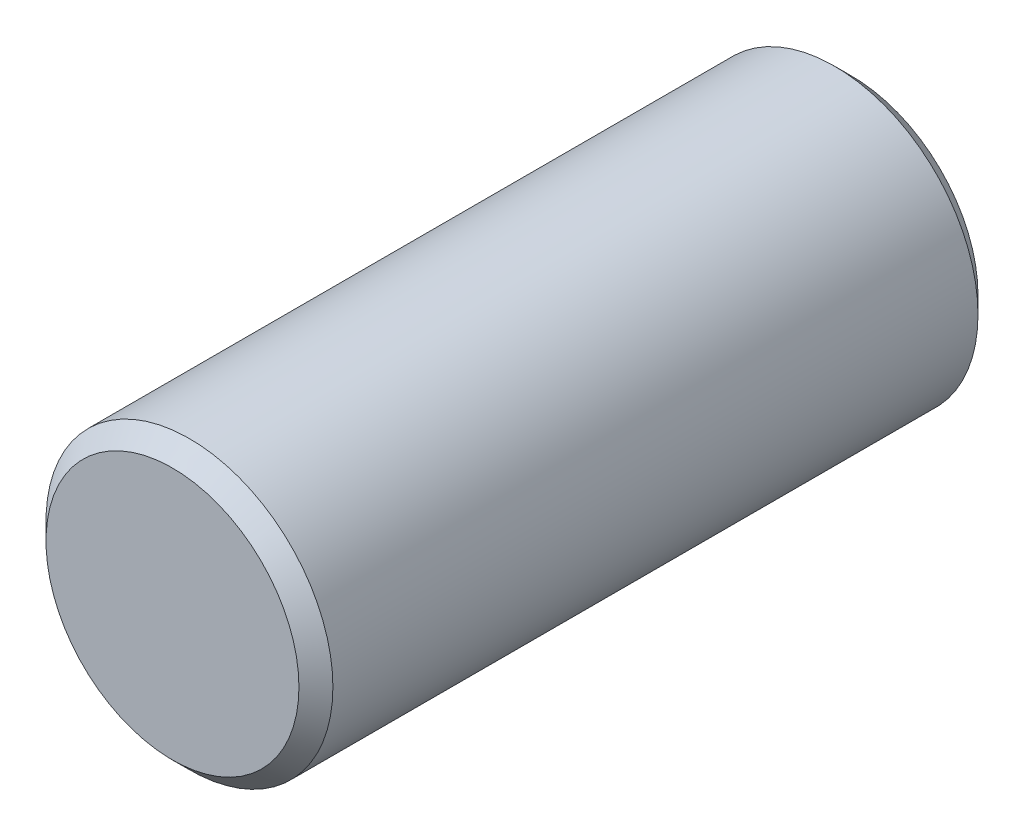
from build123d import *

# Parameters (mm, degrees)
SKETCH1_R           = 16.9
BOSS_EXTRUDE1_DEPTH = 80
CHAMFER1_SIZE       = 2


with BuildPart() as part:
    # Sketch1 → Boss-Extrude1 (new body)
    with BuildSketch(Plane.XY):
        Circle(SKETCH1_R)
    extrude(amount=BOSS_EXTRUDE1_DEPTH)

    # Chamfer1
    chamfer1_edges = [part.edges().sort_by_distance(p)[0] for p in [
        (-16.9, 0, 0),
        (-16.9, 0, 80),
    ]]
    chamfer(chamfer1_edges, length=CHAMFER1_SIZE)


solid = part.part
